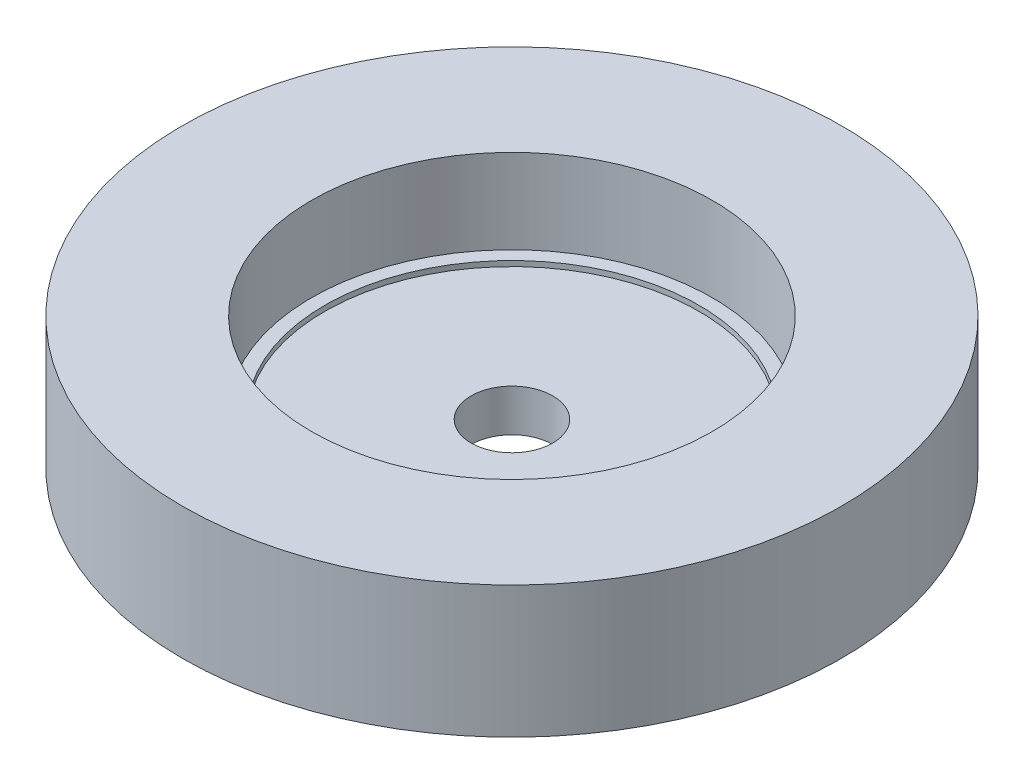
from build123d import *

# Parameters (mm, degrees)
SKETCH_1_R      = 12.5
SKETCH_1_R_2    = 7.6
EXTRUDE_1_DEPTH = 5
SKETCH_2_R      = 7.6
SKETCH_2_R_2    = 1.55
EXTRUDE_2_DEPTH = 1.6
SKETCH_3_R      = 7.6
SKETCH_3_R_2    = 7.1
EXTRUDE_3_DEPTH = 0.2


with BuildPart() as part:
    # ｽｹｯﾁ1 → ﾎﾞｽ - 押し出し1 (new body)
    with BuildSketch(Plane(origin=(0, 0, 0), x_dir=(1, 0, 0), z_dir=(0, 1, 0))):
        with Locations(Location((0, 0, 0), (0, 0, 270))):
            Circle(SKETCH_1_R)
        with Locations(Location((0, 0, 0), (0, 0, 270))):
            Circle(SKETCH_1_R_2, mode=Mode.SUBTRACT)
    extrude(amount=EXTRUDE_1_DEPTH)

    # ｽｹｯﾁ2 → ﾎﾞｽ - 押し出し2 (add)
    with BuildSketch(Plane.XZ):
        with Locations(Location((0, 0, 0), (0, 0, 270))):
            Circle(SKETCH_2_R)
        with Locations(Location((0, 0, 0), (0, 0, 270))):
            Circle(SKETCH_2_R_2, mode=Mode.SUBTRACT)
    extrude(amount=-EXTRUDE_2_DEPTH)

    # ｽｹｯﾁ3 → ﾎﾞｽ - 押し出し3 (add)
    with BuildSketch(Plane(origin=(0, 1.6, 0), x_dir=(1, 0, 0), z_dir=(0, 1, 0))):
        with Locations(Location((0, 0, 0), (0, 0, 270))):
            Circle(SKETCH_3_R)
        with Locations(Location((0, 0, 0), (0, 0, 270))):
            Circle(SKETCH_3_R_2, mode=Mode.SUBTRACT)
    extrude(amount=EXTRUDE_3_DEPTH)


solid = part.part
